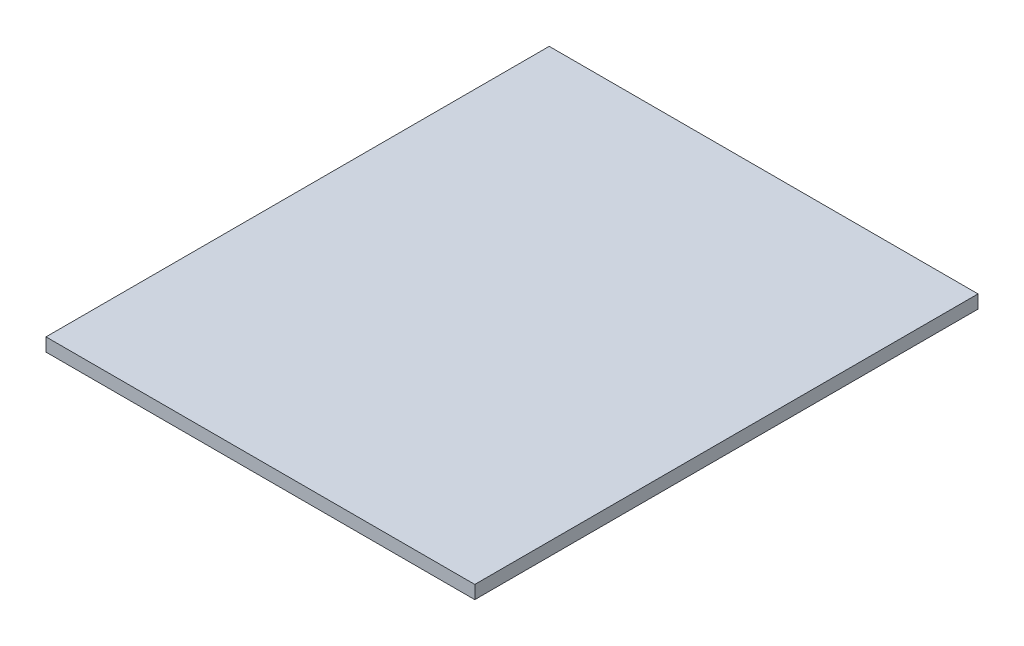
from build123d import *

# Parameters (mm, degrees)
SKETCH_1_W      = 31.8
SKETCH_1_H      = 37.32
EXTRUDE_1_DEPTH = 0.98


with BuildPart() as part:
    # 草图1 → 凸台-拉伸1 (new body)
    with BuildSketch(Plane(origin=(0, 0, 0), x_dir=(1, 0, 0), z_dir=(0, 1, 0))):
        with Locations((15.9, 18.66)):
            Rectangle(SKETCH_1_W, SKETCH_1_H)
    extrude(amount=EXTRUDE_1_DEPTH)


solid = part.part
